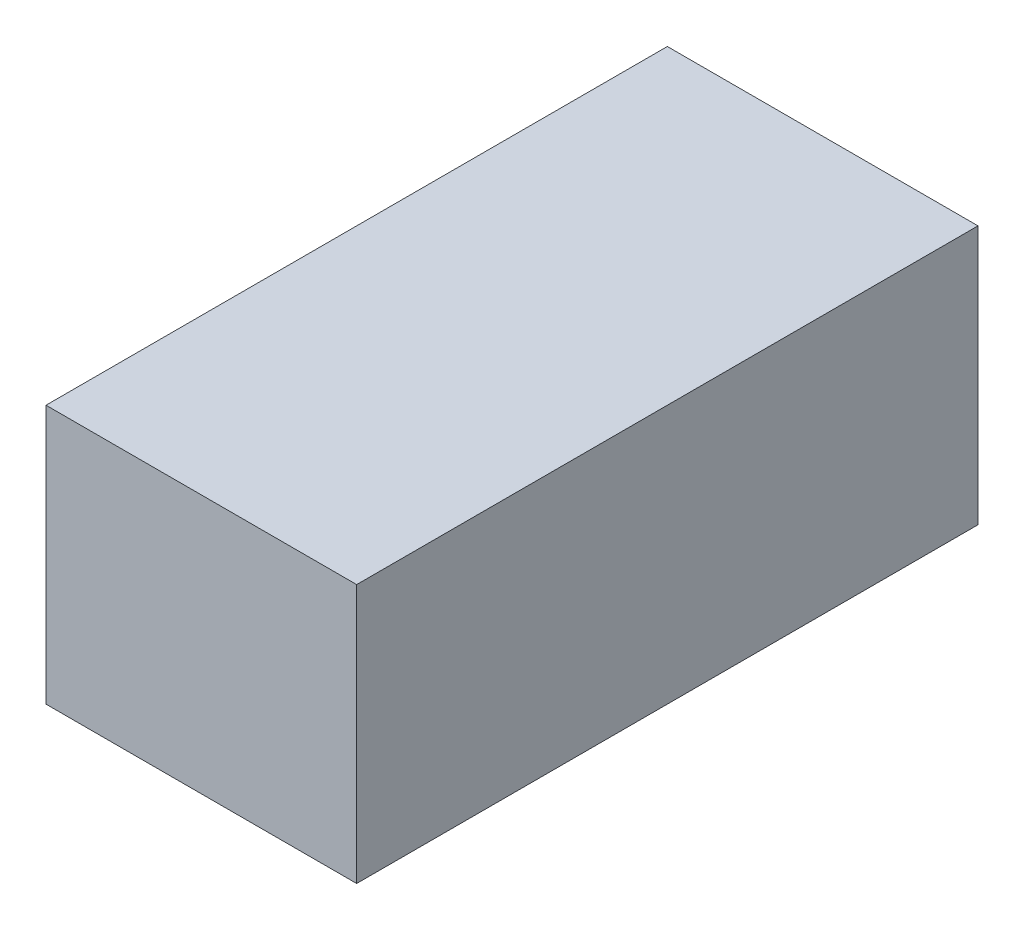
from build123d import *

# Parameters (mm, degrees)
SKETCH1_W           = 304.8
SKETCH1_H           = 609.6
BOSS_EXTRUDE1_DEPTH = 254


with BuildPart() as part:
    # Sketch1 → Boss-Extrude1 (new body)
    with BuildSketch(Plane(origin=(0, 0, 0), x_dir=(1, 0, 0), z_dir=(0, 1, 0))):
        Rectangle(SKETCH1_W, SKETCH1_H)
    extrude(amount=BOSS_EXTRUDE1_DEPTH)


solid = part.part
